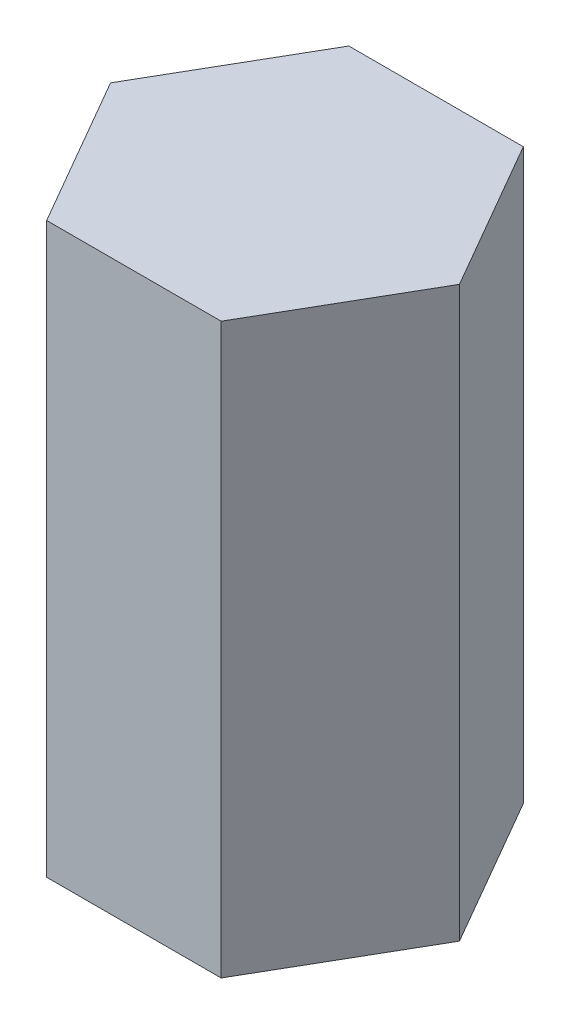
from build123d import *

# Parameters (mm, degrees)
BOSS_EXTRUDE1_DEPTH = 32


with BuildPart() as part:
    # Sketch1 → Boss-Extrude1 (new body)
    with BuildSketch(Plane(origin=(0, 0, 0), x_dir=(1, 0, 0), z_dir=(0, 1, 0))):
        Polygon((4.907477288, -8.5), (9.814954576, 0), (4.907477288, 8.5), (-4.907477288, 8.5), (-9.814954576, 0), (-4.907477288, -8.5), align=None)
    extrude(amount=BOSS_EXTRUDE1_DEPTH)


solid = part.part
